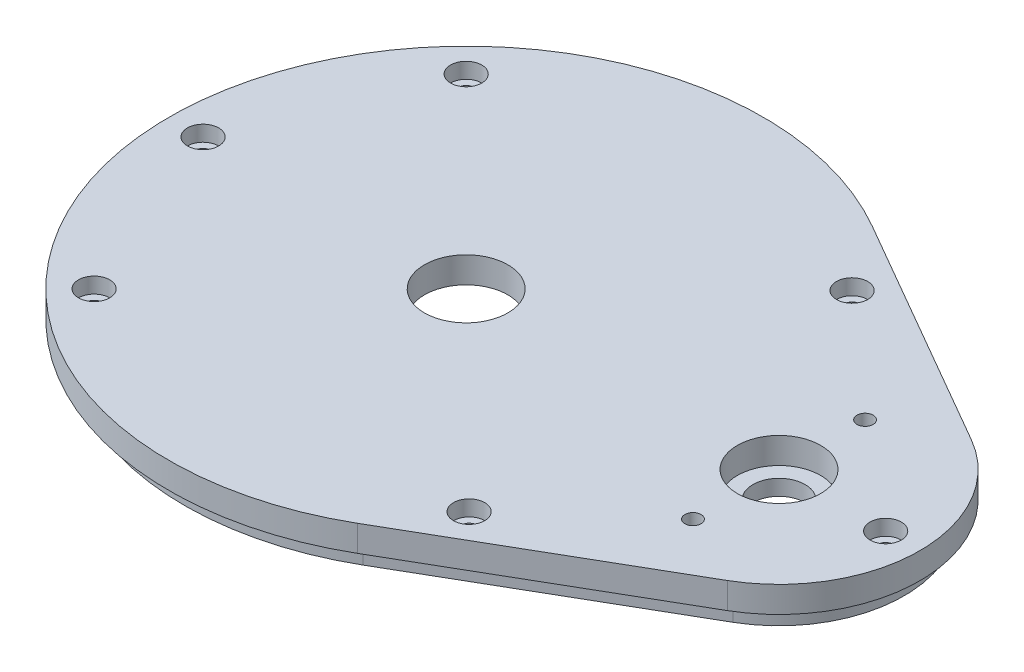
from build123d import *

# Parameters (mm, degrees)
SKETCH1_R           = 8
SKETCH1_R_2         = 1.55
BOSS_EXTRUDE1_DEPTH = 5
SKETCH2_R           = 12
SKETCH2_R_2         = 5
BOSS_EXTRUDE2_DEPTH = 3
BOSS_EXTRUDE3_DEPTH = 4
SKETCH5_R           = 1.55
CUT_EXTRUDE1_DEPTH  = 5
SKETCH6_R           = 3
CUT_EXTRUDE2_DEPTH  = 3


with BuildPart() as part:
    # Sketch1 → Boss-Extrude1 (new body)
    with BuildSketch(Plane(origin=(0, 0, 0), x_dir=(1, 0, 0), z_dir=(0, 1, 0))):
        with BuildLine():
            Line((13.5, -49.363448016), (58.5, -23.382685902))
            ThreePointArc((58.5, -23.382685902), (72, 0), (58.5, 23.382685902))
            Line((58.5, 23.382685902), (13.5, 49.363448016))
            ThreePointArc((13.5, 49.363448016), (-72, 0), (13.5, -49.363448016))
        make_face()
        with Locations(Location((-15, 0, 0), (0, 0, 270))):
            Circle(SKETCH1_R, mode=Mode.SUBTRACT)
        with Locations(Location((45, 0, 0), (0, 0, 270))):
            Circle(SKETCH1_R, mode=Mode.SUBTRACT)
        with Locations(Location((45, 16.5, 0), (0, 0, 270))):
            Circle(SKETCH1_R_2, mode=Mode.SUBTRACT)
        with Locations(Location((45, -16.5, 0), (0, 0, 270))):
            Circle(SKETCH1_R_2, mode=Mode.SUBTRACT)
    extrude(amount=BOSS_EXTRUDE1_DEPTH)

    # Sketch2 → Boss-Extrude2 (add)
    with BuildSketch(Plane.XZ):
        with Locations(Location((45, 0, 0), (0, 0, 90))):
            Circle(SKETCH2_R)
        with Locations(Location((45, 0, 0), (0, 0, 270))):
            Circle(SKETCH2_R_2, mode=Mode.SUBTRACT)
    extrude(amount=BOSS_EXTRUDE2_DEPTH)

    # Sketch4 → Boss-Extrude3 (add)
    with BuildSketch(Plane.XZ):
        with BuildLine():
            Line((12, 46.765371804), (57, 20.784609691))
            ThreePointArc((57, 20.784609691), (69, 0), (57, -20.784609691))
            Line((57, -20.784609691), (12, -46.765371804))
            ThreePointArc((12, -46.765371804), (-69, 0), (12, 46.765371804))
        make_face()
        with BuildLine():
            Line((11, -45.033320997), (56, -19.052558883))
            ThreePointArc((56, -19.052558883), (67, 0), (56, 19.052558883))
            Line((56, 19.052558883), (11, 45.033320997))
            ThreePointArc((11, 45.033320997), (-67, 0), (11, -45.033320997))
        make_face(mode=Mode.SUBTRACT)
    extrude(amount=BOSS_EXTRUDE3_DEPTH)

    # Sketch5 → Cut-Extrude1 (cut)
    with BuildSketch(Plane(origin=(0, 5, 0), x_dir=(1, 0, 0), z_dir=(0, 1, 0))):
        with Locations(Location((-65.45, 0, 0), (0, 0, 270))):
            Circle(SKETCH5_R)
        with Locations(Location((65.45, 0, 0), (0, 0, 270))):
            Circle(SKETCH5_R)
        with Locations(Location((-50.673537111, -35.673537111, 0), (0, 0, 270))):
            Circle(SKETCH5_R)
        with Locations(Location((22.284740181, 36.728311109, 0), (0, 0, 270))):
            Circle(SKETCH5_R)
        with Locations(Location((22.291641994, -36.724302618, 0), (0, 0, 270))):
            Circle(SKETCH5_R)
        with Locations(Location((-50.673537111, 35.673537111, 0), (0, 0, 270))):
            Circle(SKETCH5_R)
    extrude(amount=-CUT_EXTRUDE1_DEPTH, mode=Mode.SUBTRACT)

    # Sketch6 → Cut-Extrude2 (cut)
    with BuildSketch(Plane(origin=(0, 5, 0), x_dir=(1, 0, 0), z_dir=(0, 1, 0))):
        with Locations(Location((-50.673537111, 35.673537111, 0), (0, 0, 270))):
            Circle(SKETCH6_R)
        with Locations(Location((-65.45, 0, 0), (0, 0, 270))):
            Circle(SKETCH6_R)
        with Locations(Location((-50.673537111, -35.673537111, 0), (0, 0, 270))):
            Circle(SKETCH6_R)
        with Locations(Location((22.291641994, -36.724302618, 0), (0, 0, 270))):
            Circle(SKETCH6_R)
        with Locations(Location((22.284740181, 36.728311109, 0), (0, 0, 270))):
            Circle(SKETCH6_R)
        with Locations(Location((65.45, 0, 0), (0, 0, 270))):
            Circle(SKETCH6_R)
    extrude(amount=-CUT_EXTRUDE2_DEPTH, mode=Mode.SUBTRACT)


solid = part.part
